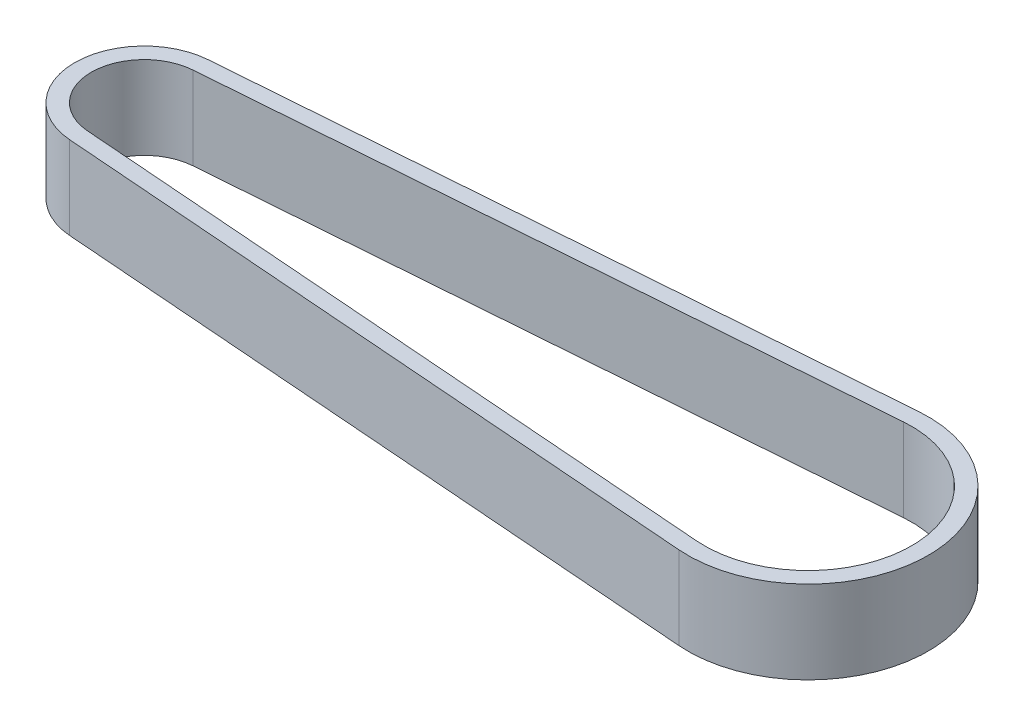
from build123d import *

# Parameters (mm, degrees)
BOSS_EXTRUDE1_DEPTH = 10


with BuildPart() as part:
    # Sketch1 → Boss-Extrude1 (new body)
    with BuildSketch(Plane(origin=(0, 0, 0), x_dir=(1, 0, 0), z_dir=(0, 1, 0))):
        with BuildLine():
            Line((-0.63925875, 8.345552603), (78.89409, 14.437706295))
            ThreePointArc((78.89409, 14.437706295), (94.48, 0), (78.89409, -14.437706295))
            Line((78.89409, -14.437706295), (-0.63925875, -8.345552603))
            ThreePointArc((-0.63925875, -8.345552603), (-8.37, 0), (-0.63925875, 8.345552603))
        make_face()
        with BuildLine():
            Line((-0.48650875, 6.351394275), (79.04684, 12.443547967))
            ThreePointArc((79.04684, 12.443547967), (92.48, 0), (79.04684, -12.443547967))
            Line((79.04684, -12.443547967), (-0.48650875, -6.351394275))
            ThreePointArc((-0.48650875, -6.351394275), (-6.37, 0), (-0.48650875, 6.351394275))
        make_face(mode=Mode.SUBTRACT)
    extrude(amount=BOSS_EXTRUDE1_DEPTH)


solid = part.part
